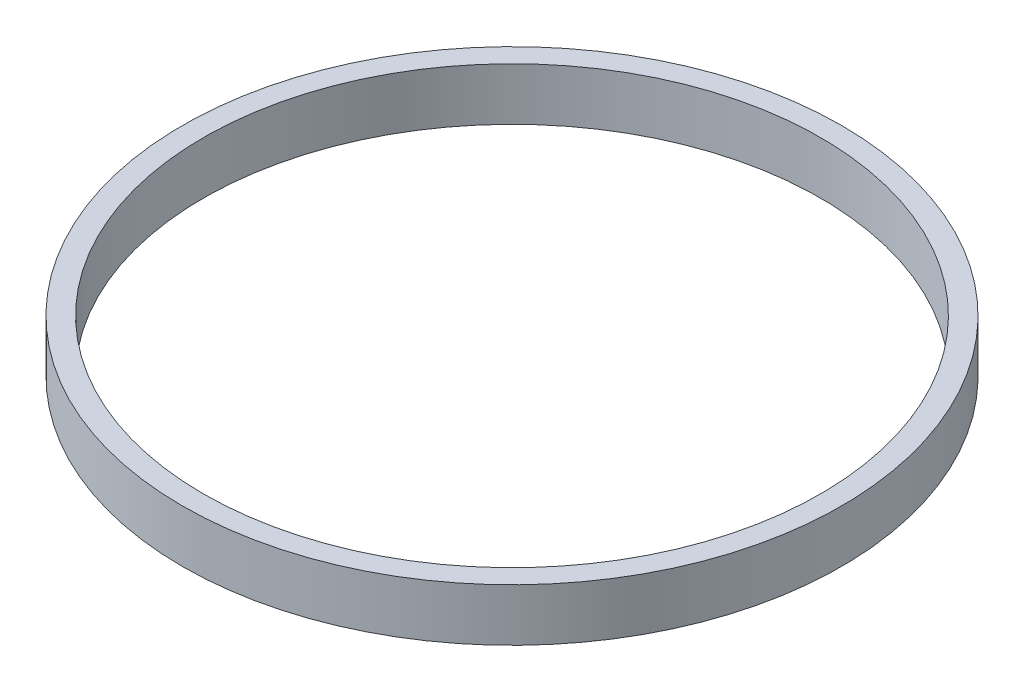
from build123d import *

# Parameters (mm, degrees)
SKETCH1_R           = 62.833006194
SKETCH1_R_2         = 58.838
BOSS_EXTRUDE1_DEPTH = 10


with BuildPart() as part:
    # Sketch1 → Boss-Extrude1 (new body)
    with BuildSketch(Plane(origin=(0, 0, 0), x_dir=(0.9998727759206639, 0, 0.01595092388251767), z_dir=(0, 1, 0))):
        with Locations(Location((4.002282363, 4.818066557, 0), (0, 0, 270.913959377))):
            Circle(SKETCH1_R)
        with Locations(Location((4.002282363, 4.818066557, 0), (0, 0, 270.913959377))):
            Circle(SKETCH1_R_2, mode=Mode.SUBTRACT)
    extrude(amount=BOSS_EXTRUDE1_DEPTH)


solid = part.part
